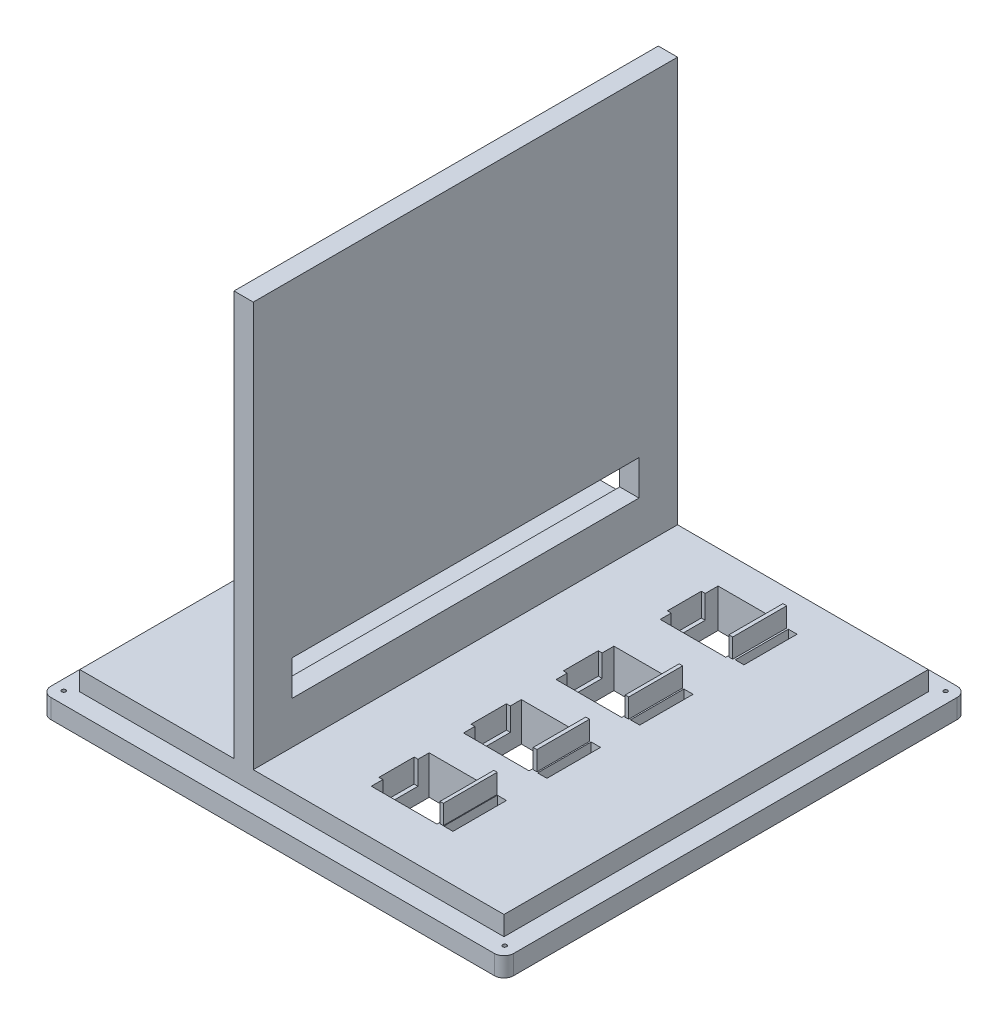
from build123d import *

# Parameters (mm, degrees)
BOSS_EXTRUDE1_DEPTH          = 4
BOSS_EXTRUDE1_DEPTH_BACK     = 1
SKETCH1_W                    = 120
SKETCH1_H                    = 120
FILLET1_R                    = 2.5
SKETCH34_W                   = 110
SKETCH34_H                   = 110
BOSS_EXTRUDE4_DEPTH          = 5
SKETCH35_W                   = 5
SKETCH35_H                   = 110
BOSS_EXTRUDE5_DEPTH          = 105
SKETCH36_W                   = 90
SKETCH36_H                   = 9.090388829
CUT_EXTRUDE17_DEPTH          = 5
F_97_0_0059_DIAMETER_HOLE2_D = 0.14986
F_1_0MM_DOWEL_HOLE1_D        = 1
SKETCH46_W                   = 17
SKETCH46_H                   = 15
CUT_EXTRUDE23_DEPTH          = 10
SKETCH50_W                   = 17
SKETCH50_H                   = 15
CUT_EXTRUDE24_DEPTH          = 10
SKETCH51_W                   = 17
SKETCH51_H                   = 15
CUT_EXTRUDE25_DEPTH          = 10
SKETCH52_W                   = 17
SKETCH52_H                   = 15
CUT_EXTRUDE26_DEPTH          = 10
SKETCH53_W                   = 0.977162156
SKETCH53_H                   = 13.998719243
BOSS_EXTRUDE6_DEPTH          = 5
SKETCH55_W                   = 2.272024092
SKETCH55_H                   = 13.774773728
CUT_EXTRUDE27_DEPTH          = 5
SKETCH56_W                   = 0.906735868
SKETCH56_H                   = 14
BOSS_EXTRUDE7_DEPTH          = 5
SKETCH57_W                   = 2.385496373
SKETCH57_H                   = 13.848261841
CUT_EXTRUDE28_DEPTH          = 5
SKETCH58_W                   = 0.96928262
SKETCH58_H                   = 13.634621905
BOSS_EXTRUDE8_DEPTH          = 5
SKETCH59_W                   = 2.435671648
SKETCH59_H                   = 13.900580395
CUT_EXTRUDE29_DEPTH          = 5
SKETCH60_W                   = 0.869613575
SKETCH60_H                   = 13.953535455
BOSS_EXTRUDE10_DEPTH         = 5
SKETCH62_W                   = 2.354070132
SKETCH62_H                   = 13.876017007
CUT_EXTRUDE30_DEPTH          = 5
SKETCH63_W                   = 9.117005695
SKETCH63_H                   = 6.066926996
CUT_EXTRUDE33_DEPTH          = 1
SKETCH64_W                   = 9.176846486
SKETCH64_H                   = 5.926214746
CUT_EXTRUDE34_DEPTH          = 1
SKETCH65_W                   = 9.062729826
SKETCH65_H                   = 5.966132982
CUT_EXTRUDE35_DEPTH          = 1
SKETCH67_W                   = 8.803701295
SKETCH67_H                   = 6.022435514
CUT_EXTRUDE36_DEPTH          = 1


with BuildPart() as part:
    # Sketch1 → Boss-Extrude1 (new, two sides: drawn at the far end of the back side and taken through both)
    with BuildSketch(Plane(origin=(0, 0, 0), x_dir=(1, 0, 0), z_dir=(0, 1, 0)).offset(-BOSS_EXTRUDE1_DEPTH_BACK)):
        Rectangle(SKETCH1_W, SKETCH1_H)
    extrude(amount=BOSS_EXTRUDE1_DEPTH + BOSS_EXTRUDE1_DEPTH_BACK)

    # Fillet1
    fillet1_edges = [part.edges().sort_by_distance(p)[0] for p in [
        (-60, 1.5, 60),
        (-60, 1.5, -60),
        (60, 1.5, -60),
        (60, 1.5, 60),
    ]]
    fillet(fillet1_edges, radius=FILLET1_R)

    # Sketch34 → Boss-Extrude4 (add)
    with BuildSketch(Plane(origin=(0, 4, 0), x_dir=(1, 0, 0), z_dir=(0, 1, 0))):
        Rectangle(SKETCH34_W, SKETCH34_H)
    extrude(amount=BOSS_EXTRUDE4_DEPTH)

    # Sketch35 → Boss-Extrude5 (add)
    with BuildSketch(Plane(origin=(0, 9, 0), x_dir=(1, 0, 0), z_dir=(0, 1, 0))):
        with Locations((-12.5, 0)):
            Rectangle(SKETCH35_W, SKETCH35_H)
    extrude(amount=BOSS_EXTRUDE5_DEPTH)

    # Sketch36 → Cut-Extrude17 (cut)
    with BuildSketch(Plane(origin=(-15, 5, 0), x_dir=(0, 0, 1), z_dir=(-1, 0, 0))):
        with Locations((0, 19.545194415)):
            Rectangle(SKETCH36_W, SKETCH36_H)
    extrude(amount=-CUT_EXTRUDE17_DEPTH, mode=Mode.SUBTRACT)

    # #97 (0.0059) Diameter Hole2 (through all)
    with Locations(Plane(origin=(0, -1, 0), x_dir=(-1, 0, 0), z_dir=(0, -1, 0))):
        with Locations((57.307733748, 57.378842828), (-57.10337646, 57.378842828), (-57.10337646, -56.921022458), (57.307733748, -56.921022458)):
            Hole(F_97_0_0059_DIAMETER_HOLE2_D / 2)

    # Ø1.0mm Dowel Hole1 (through all)
    with Locations(Plane(origin=(0, -1, 0), x_dir=(-1, 0, 0), z_dir=(0, -1, 0))):
        with Locations((57.307733748, -56.846092458), (-57.10337646, -56.921022458), (-57.10337646, 57.378842828), (57.307733748, 57.378842828)):
            Hole(F_1_0MM_DOWEL_HOLE1_D / 2)

    # Sketch46 → Cut-Extrude23 (cut)
    with BuildSketch(Plane(origin=(0, -1, 4), x_dir=(1, 0, 0), z_dir=(0, -1, 0))):
        with Locations((17.5, 31.9)):
            Rectangle(SKETCH46_W, SKETCH46_H)
    extrude(amount=-CUT_EXTRUDE23_DEPTH, mode=Mode.SUBTRACT)

    # Sketch50 → Cut-Extrude24 (cut)
    with BuildSketch(Plane(origin=(0, -1, 5), x_dir=(-1, 0, 0), z_dir=(0, -1, 0))):
        with Locations((-17.5, -7)):
            Rectangle(SKETCH50_W, SKETCH50_H)
    extrude(amount=-CUT_EXTRUDE24_DEPTH, mode=Mode.SUBTRACT)

    # Sketch51 → Cut-Extrude25 (cut)
    with BuildSketch(Plane(origin=(0, -1, 6), x_dir=(-1, 0, 0), z_dir=(0, -1, 0))):
        with Locations((-17.5, 18)):
            Rectangle(SKETCH51_W, SKETCH51_H)
    extrude(amount=-CUT_EXTRUDE25_DEPTH, mode=Mode.SUBTRACT)

    # Sketch52 → Cut-Extrude26 (cut)
    with BuildSketch(Plane(origin=(0, -1, 4), x_dir=(1, 0, 0), z_dir=(0, -1, 0))):
        with Locations((17.5, -43)):
            Rectangle(SKETCH52_W, SKETCH52_H)
    extrude(amount=-CUT_EXTRUDE26_DEPTH, mode=Mode.SUBTRACT)

    # Sketch53 → Boss-Extrude6 (add)
    with BuildSketch(Plane(origin=(-2.93050065, 9, 0.122093772), x_dir=(1, 0, 0), z_dir=(0, 1, 0))):
        with Locations((29.779301797, 39.085351217)):
            Rectangle(SKETCH53_W, SKETCH53_H)
    extrude(amount=BOSS_EXTRUDE6_DEPTH)

    # Sketch55 → Cut-Extrude27 (cut)
    with BuildSketch(Plane(origin=(-2.539176839, 9, 0.049591215), x_dir=(1, 0, 0), z_dir=(0, 1, 0))):
        with Locations((31.467069737, 39.084159637)):
            Rectangle(SKETCH55_W, SKETCH55_H)
    extrude(amount=-CUT_EXTRUDE27_DEPTH, mode=Mode.SUBTRACT)

    # Sketch56 → Boss-Extrude7 (add)
    with BuildSketch(Plane(origin=(-2.001675953, 9, 0), x_dir=(1, 0, 0), z_dir=(0, 1, 0))):
        with Locations((28.881264054, 12)):
            Rectangle(SKETCH56_W, SKETCH56_H)
    extrude(amount=BOSS_EXTRUDE7_DEPTH)

    # Sketch57 → Cut-Extrude28 (cut)
    with BuildSketch(Plane(origin=(-2.324919513, 9, 0), x_dir=(1, 0, 0), z_dir=(0, 1, 0))):
        with Locations((31.20631194, 12.028513798)):
            Rectangle(SKETCH57_W, SKETCH57_H)
    extrude(amount=-CUT_EXTRUDE28_DEPTH, mode=Mode.SUBTRACT)

    # Sketch58 → Boss-Extrude8 (add)
    with BuildSketch(Plane(origin=(-1.839703038, 9, 0), x_dir=(1, 0, 0), z_dir=(0, 1, 0))):
        with Locations((28.596634058, -11.879280286)):
            Rectangle(SKETCH58_W, SKETCH58_H)
    extrude(amount=BOSS_EXTRUDE8_DEPTH)

    # Sketch59 → Cut-Extrude29 (cut)
    with BuildSketch(Plane(origin=(-2.765819175, 9, 0), x_dir=(1, 0, 0), z_dir=(0, 1, 0))):
        with Locations((31.546866825, -11.916750925)):
            Rectangle(SKETCH59_W, SKETCH59_H)
    extrude(amount=-CUT_EXTRUDE29_DEPTH, mode=Mode.SUBTRACT)

    # Sketch60 → Boss-Extrude10 (add)
    with BuildSketch(Plane(origin=(-1.803689022, 9, -0.186210488), x_dir=(1, 0, 0), z_dir=(0, 1, 0))):
        with Locations((28.551773242, -36.1181464)):
            Rectangle(SKETCH60_W, SKETCH60_H)
    extrude(amount=BOSS_EXTRUDE10_DEPTH)

    # Sketch62 → Cut-Extrude30 (cut)
    with BuildSketch(Plane(origin=(-2.856074078, 9, -0.042608941), x_dir=(1, 0, 0), z_dir=(0, 1, 0))):
        with Locations((31.403731497, -36.065246957)):
            Rectangle(SKETCH62_W, SKETCH62_H)
    extrude(amount=-CUT_EXTRUDE30_DEPTH, mode=Mode.SUBTRACT)

    # Sketch63 → Cut-Extrude33 (cut)
    with BuildSketch(Plane(origin=(9, 0, 0), x_dir=(0, 0, -1), z_dir=(1, 0, 0))):
        with Locations((-35.854544031, 5.966536502)):
            Rectangle(SKETCH63_W, SKETCH63_H)
    extrude(amount=-CUT_EXTRUDE33_DEPTH, mode=Mode.SUBTRACT)

    # Sketch64 → Cut-Extrude34 (cut)
    with BuildSketch(Plane(origin=(9, 0, 0), x_dir=(0, 0, -1), z_dir=(1, 0, 0))):
        with Locations((-11.959924601, 6.036892627)):
            Rectangle(SKETCH64_W, SKETCH64_H)
    extrude(amount=-CUT_EXTRUDE34_DEPTH, mode=Mode.SUBTRACT)

    # Sketch65 → Cut-Extrude35 (cut)
    with BuildSketch(Plane(origin=(9, 0.251826278, 0.170802287), x_dir=(0, 0, -1), z_dir=(1, 0, 0))):
        with Locations((12.086740933, 6.016933509)):
            Rectangle(SKETCH65_W, SKETCH65_H)
    extrude(amount=-CUT_EXTRUDE35_DEPTH, mode=Mode.SUBTRACT)

    # Sketch67 → Cut-Extrude36 (cut)
    with BuildSketch(Plane(origin=(9, 0, 0), x_dir=(0, 0, -1), z_dir=(1, 0, 0))):
        with Locations((38.763636035, 5.988782243)):
            Rectangle(SKETCH67_W, SKETCH67_H)
    extrude(amount=-CUT_EXTRUDE36_DEPTH, mode=Mode.SUBTRACT)


solid = part.part
